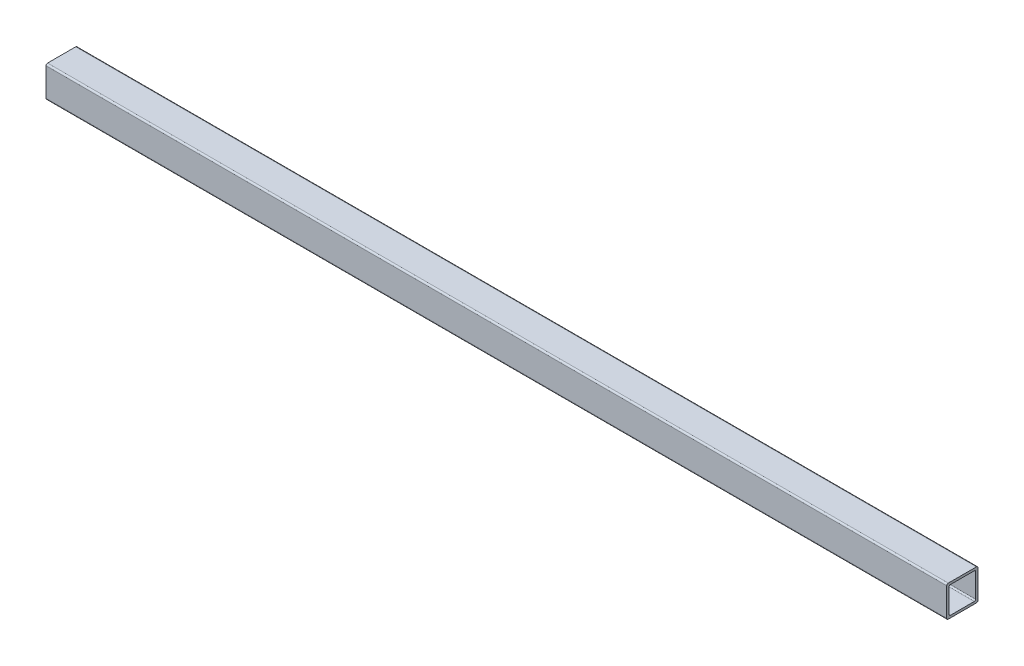
from build123d import *

# Parameters (mm, degrees)
SQUARE_TUBE_2_5X2_5X_188_A500_1_DEPTH = 1828.8


with BuildPart() as part:
    # Sketch12 → Square tube 2.5X2.5X.188 A500(1) (new body)
    with BuildSketch(Plane(origin=(914.4, 0, 0), x_dir=(0, -1, 0), z_dir=(-1, 0, 0))):
        with BuildLine():
            Line((28.575, -31.75), (-28.575, -31.75))
            ThreePointArc((-28.575, -31.75), (-30.82006403, -30.82006403), (-31.75, -28.575))
            Line((-31.75, -28.575), (-31.75, 28.575))
            ThreePointArc((-31.75, 28.575), (-30.82006403, 30.82006403), (-28.575, 31.75))
            Line((-28.575, 31.75), (28.575, 31.75))
            ThreePointArc((28.575, 31.75), (30.82006403, 30.82006403), (31.75, 28.575))
            Line((31.75, 28.575), (31.75, -28.575))
            ThreePointArc((31.75, -28.575), (30.82006403, -30.82006403), (28.575, -31.75))
        make_face()
        with BuildLine():
            Line((24.27732, 26.9748), (-24.27732, 26.9748))
            ThreePointArc((-24.27732, 26.9748), (-26.1847264, 26.1847264), (-26.9748, 24.27732))
            Line((-26.9748, 24.27732), (-26.9748, -24.27732))
            ThreePointArc((-26.9748, -24.27732), (-26.1847264, -26.1847264), (-24.27732, -26.9748))
            Line((-24.27732, -26.9748), (24.27732, -26.9748))
            ThreePointArc((24.27732, -26.9748), (26.1847264, -26.1847264), (26.9748, -24.27732))
            Line((26.9748, -24.27732), (26.9748, 24.27732))
            ThreePointArc((26.9748, 24.27732), (26.1847264, 26.1847264), (24.27732, 26.9748))
        make_face(mode=Mode.SUBTRACT)
    extrude(amount=SQUARE_TUBE_2_5X2_5X_188_A500_1_DEPTH)


solid = part.part
